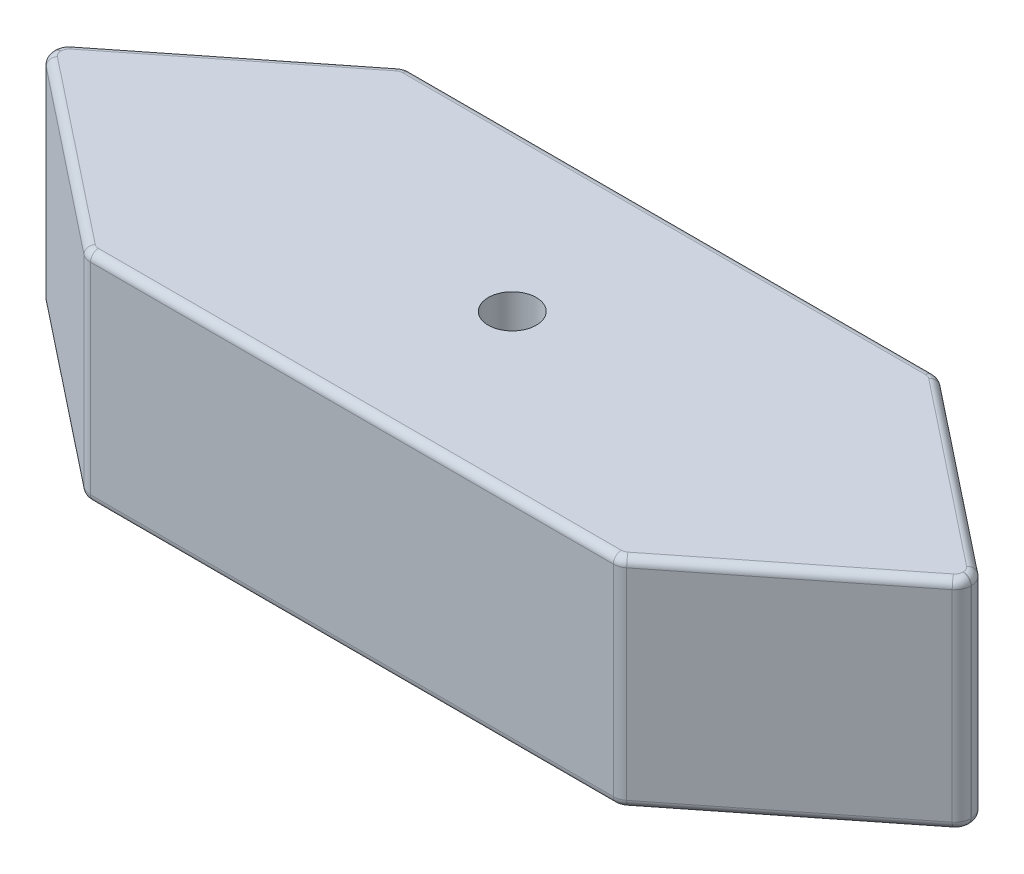
from build123d import *

# Parameters (mm, degrees)
BOSS_EXTRUDE1_DEPTH      = 31.75
BOSS_EXTRUDE1_DEPTH_BACK = 31.75
SKETCH1_W                = 182.099207872
SKETCH1_H                = 43.109258089
SKETCH2_W                = 205.659157106
SKETCH2_H                = 99.146034208
CUT_EXTRUDE1_DEPTH       = 190.806723118
SKETCH3_R                = 4.7625
CUT_EXTRUDE2_DEPTH       = 190.806723118
FILLET1_R                = 1.5875


with BuildPart() as part:
    # Sketch1 → Boss-Extrude1 (new, two sides: drawn at the far end of the back side and taken through both)
    with BuildSketch(Plane.XY.offset(-BOSS_EXTRUDE1_DEPTH_BACK)):
        with Locations((91.049603936, 217.262286974)):
            Rectangle(SKETCH1_W, SKETCH1_H)
    extrude(amount=BOSS_EXTRUDE1_DEPTH + BOSS_EXTRUDE1_DEPTH_BACK)

    # Sketch2 → Cut-Extrude1 (cut, through all)
    with BuildSketch(Plane(origin=(0, 238.816916018, 0), x_dir=(1, 0, 0), z_dir=(0, 1, 0))):
        with Locations((89.350434008, 0.474866742)):
            Rectangle(SKETCH2_W, SKETCH2_H)
        with BuildLine():
            Line((1.204268152, -2.540878953), (37.233910096, -31.064345493))
            ThreePointArc((37.233910096, -31.064345493), (38.161341158, -31.573691126), (39.204641944, -31.75))
            Line((39.204641944, -31.75), (142.894565928, -31.75))
            ThreePointArc((142.894565928, -31.75), (143.937866714, -31.573691126), (144.865297776, -31.064345493))
            Line((144.865297776, -31.064345493), (180.894939721, -2.540878953))
            ThreePointArc((180.894939721, -2.540878953), (181.782327763, -1.43420323), (182.099207872, -0.051533461))
            Line((182.099207872, -0.051533461), (182.099207872, 0.051533461))
            ThreePointArc((182.099207872, 0.051533461), (181.782327763, 1.43420323), (180.894939721, 2.540878953))
            Line((180.894939721, 2.540878953), (144.865297776, 31.064345493))
            ThreePointArc((144.865297776, 31.064345493), (143.937866714, 31.573691126), (142.894565928, 31.75))
            Line((142.894565928, 31.75), (39.204641944, 31.75))
            ThreePointArc((39.204641944, 31.75), (38.161341158, 31.573691126), (37.233910096, 31.064345493))
            Line((37.233910096, 31.064345493), (1.204268152, 2.540878953))
            ThreePointArc((1.204268152, 2.540878953), (0.316880109, 1.43420323), (0, 0.051533461))
            Line((0, 0.051533461), (0, -0.051533461))
            ThreePointArc((0, -0.051533461), (0.316880109, -1.43420323), (1.204268152, -2.540878953))
        make_face(mode=Mode.SUBTRACT)
    extrude(amount=-CUT_EXTRUDE1_DEPTH, mode=Mode.SUBTRACT)

    # Sketch3 → Cut-Extrude2 (cut, through all)
    with BuildSketch(Plane.XZ.offset(-195.707657929)):
        with Locations((91.049603936, -0.051533461)):
            Circle(SKETCH3_R)
    extrude(amount=-CUT_EXTRUDE2_DEPTH, mode=Mode.SUBTRACT)

    # Fillet1
    fillet1_edges = [part.edges().sort_by_distance(p)[0] for p in [
        (143.937866714, 238.816916018, 31.573691126),
        (162.880118749, 238.816916018, 16.802612223),
        (181.782327763, 238.816916018, 1.43420323),
        (182.099207872, 238.816916018, 0),
        (181.782327763, 238.816916018, -1.43420323),
        (162.880118749, 238.816916018, -16.802612223),
        (143.937866714, 238.816916018, -31.573691126),
        (91.049603936, 238.816916018, -31.75),
        (38.161341158, 238.816916018, -31.573691126),
        (19.219089124, 238.816916018, -16.802612223),
        (0.316880109, 238.816916018, -1.43420323),
        (0, 238.816916018, 0),
        (0.316880109, 238.816916018, 1.43420323),
        (19.219089124, 238.816916018, 16.802612223),
        (38.161341158, 238.816916018, 31.573691126),
        (38.161341158, 195.707657929, 31.573691126),
        (19.219089124, 195.707657929, 16.802612223),
        (0.316880109, 195.707657929, 1.43420323),
        (0, 195.707657929, 0),
        (0.316880109, 195.707657929, -1.43420323),
        (19.219089124, 195.707657929, -16.802612223),
        (38.161341158, 195.707657929, -31.573691126),
        (91.049603936, 195.707657929, -31.75),
        (143.937866714, 195.707657929, -31.573691126),
        (162.880118749, 195.707657929, -16.802612223),
        (181.782327763, 195.707657929, -1.43420323),
        (182.099207872, 195.707657929, 0),
        (181.782327763, 195.707657929, 1.43420323),
        (162.880118749, 195.707657929, 16.802612223),
        (143.937866714, 195.707657929, 31.573691126),
        (91.049603936, 238.816916018, 31.75),
        (91.049603936, 195.707657929, 31.75),
    ]]
    fillet(fillet1_edges, radius=FILLET1_R)


solid = part.part
